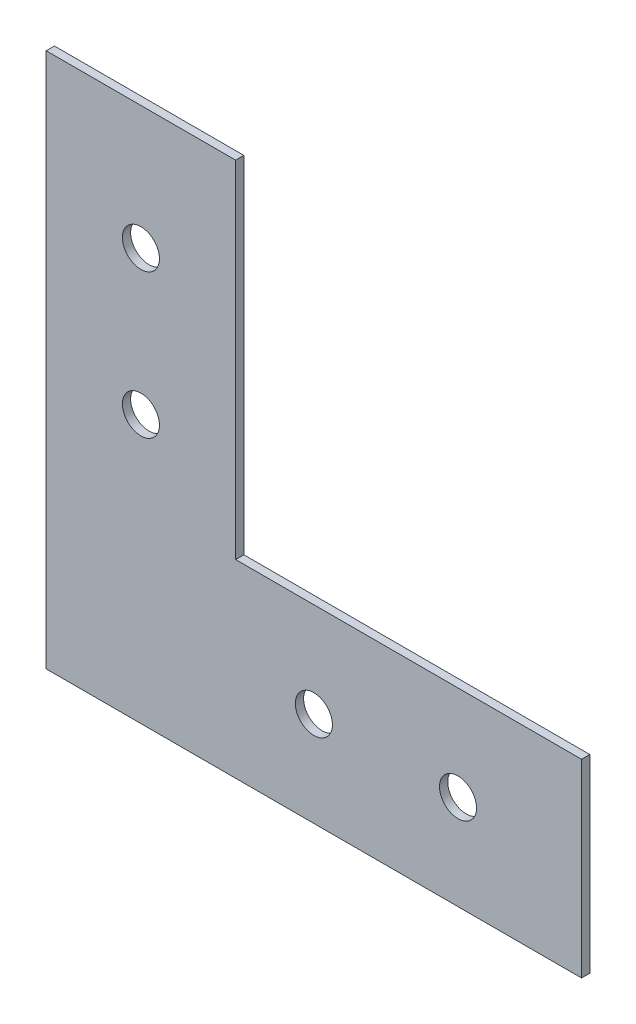
from build123d import *

# Parameters (mm, degrees)
SKETCH_1_R      = 4.5
EXTRUDE_1_DEPTH = 2


with BuildPart() as part:
    # 草图1 → 凸台-拉伸1 (new body)
    with BuildSketch(Plane.XY):
        Polygon((0, 130), (0, 0), (130, 0), (130, 46), (46, 46), (46, 130), align=None)
        with Locations((23, 100)):
            Circle(SKETCH_1_R, mode=Mode.SUBTRACT)
        with Locations((23, 65)):
            Circle(SKETCH_1_R, mode=Mode.SUBTRACT)
        with Locations((65, 23)):
            Circle(SKETCH_1_R, mode=Mode.SUBTRACT)
        with Locations((100, 23)):
            Circle(SKETCH_1_R, mode=Mode.SUBTRACT)
    extrude(amount=EXTRUDE_1_DEPTH)


solid = part.part
